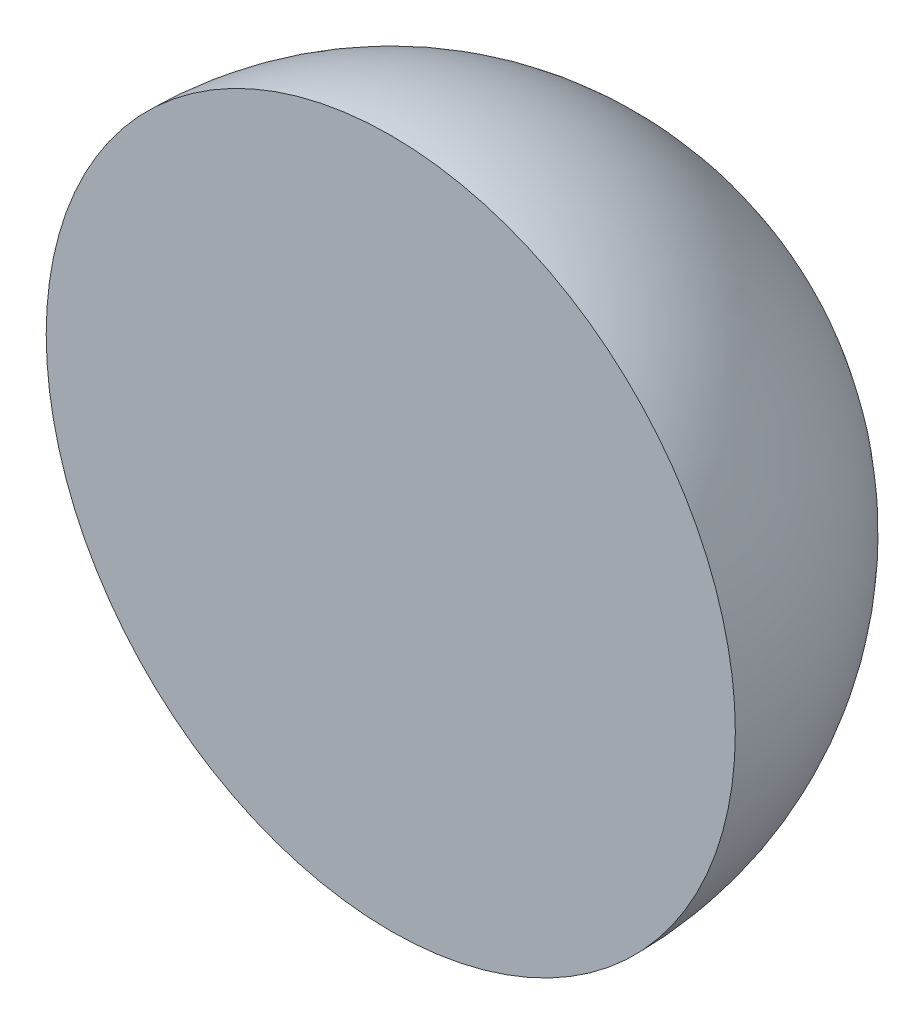
from build123d import *

# Parameters (mm, degrees)
SCALE1_SCALE = 0.6


with BuildPart() as part:
    # Sketch1 → Revolve1 (revolve)
    with BuildSketch(Plane(origin=(0, 0, 0), x_dir=(0, 0, -1), z_dir=(1, 0, 0))):
        with BuildLine():
            Line((0, 5.9944), (0, 0))
            Line((0, 0), (5.9944, 0))
            ThreePointArc((5.9944, 0), (4.238680889, 4.238680889), (0, 5.9944))
        make_face()
    revolve(axis=Axis((0, 0, 3.08384281), (0, 0, -1)))


with BuildPart() as part_1:
    # Scale1: scaled about (0, 0, -2.2479)
    add(part.part.scale(SCALE1_SCALE).moved(Location((0, 0, -0.89916))))


solid = part_1.part
